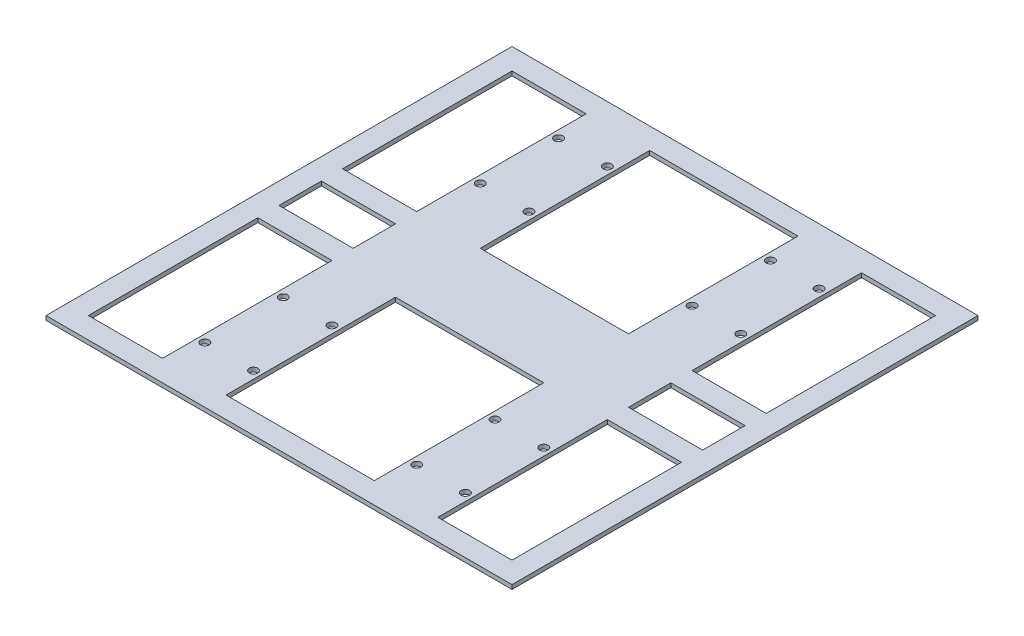
from build123d import *

# Parameters (mm, degrees)
SKETCH_2_W          = 220
SKETCH_2_H          = 220
SKETCH_2_W_2        = 35
SKETCH_2_H_2        = 80
SKETCH_2_W_3        = 70
SKETCH_2_H_3        = 20
EXTRUDE_1_DEPTH     = 2
SKETCH_3_R          = 2
CUT_EXTRUDE_1_DEPTH = 2


with BuildPart() as part:
    # Эскиз2 → Бобышка-Вытянуть1 (new body)
    with BuildSketch(Plane(origin=(0, 0, 0), x_dir=(1, 0, 0), z_dir=(0, 1, 0))):
        with Locations((110, 110)):
            Rectangle(SKETCH_2_W, SKETCH_2_H)
        with Locations((27.5, 170)):
            Rectangle(SKETCH_2_W_2, SKETCH_2_H_2, mode=Mode.SUBTRACT)
        with Locations((110, 170)):
            Rectangle(SKETCH_2_W_3, SKETCH_2_H_2, mode=Mode.SUBTRACT)
        with Locations((192.5, 170)):
            Rectangle(SKETCH_2_W_2, SKETCH_2_H_2, mode=Mode.SUBTRACT)
        with Locations((192.5, 50)):
            Rectangle(SKETCH_2_W_2, SKETCH_2_H_2, mode=Mode.SUBTRACT)
        with Locations((110, 50)):
            Rectangle(SKETCH_2_W_3, SKETCH_2_H_2, mode=Mode.SUBTRACT)
        with Locations((27.5, 50)):
            Rectangle(SKETCH_2_W_2, SKETCH_2_H_2, mode=Mode.SUBTRACT)
        with Locations((27.5, 110)):
            Rectangle(SKETCH_2_W_2, SKETCH_2_H_3, mode=Mode.SUBTRACT)
        with Locations((192.5, 110)):
            Rectangle(SKETCH_2_W_2, SKETCH_2_H_3, mode=Mode.SUBTRACT)
    extrude(amount=EXTRUDE_1_DEPTH)

    # Эскиз3 → Вырез-Вытянуть1 (cut)
    with BuildSketch(Plane(origin=(0, 2, 0), x_dir=(1, 0, 0), z_dir=(0, 1, 0))):
        with Locations(Location((171.5, 26.5, 0), (0, 0, 270))):
            Circle(SKETCH_3_R)
        with Locations(Location((148.5, 26.5, 0), (0, 0, 270))):
            Circle(SKETCH_3_R)
        with Locations(Location((71.5, 26.5, 0), (0, 0, 270))):
            Circle(SKETCH_3_R)
        with Locations(Location((48.5, 26.5, 0), (0, 0, 270))):
            Circle(SKETCH_3_R)
        with Locations(Location((48.5, 63.5, 0), (0, 0, 270))):
            Circle(SKETCH_3_R)
        with Locations(Location((71.5, 63.5, 0), (0, 0, 270))):
            Circle(SKETCH_3_R)
        with Locations(Location((148.5, 63.5, 0), (0, 0, 270))):
            Circle(SKETCH_3_R)
        with Locations(Location((171.5, 63.5, 0), (0, 0, 270))):
            Circle(SKETCH_3_R)
        with Locations(Location((171.5, 156.5, 0), (0, 0, 270))):
            Circle(SKETCH_3_R)
        with Locations(Location((148.5, 156.5, 0), (0, 0, 270))):
            Circle(SKETCH_3_R)
        with Locations(Location((148.5, 193.5, 0), (0, 0, 270))):
            Circle(SKETCH_3_R)
        with Locations(Location((171.5, 193.5, 0), (0, 0, 270))):
            Circle(SKETCH_3_R)
        with Locations(Location((71.5, 193.5, 0), (0, 0, 270))):
            Circle(SKETCH_3_R)
        with Locations(Location((71.5, 156.5, 0), (0, 0, 270))):
            Circle(SKETCH_3_R)
        with Locations(Location((48.5, 156.5, 0), (0, 0, 270))):
            Circle(SKETCH_3_R)
        with Locations(Location((48.5, 193.5, 0), (0, 0, 270))):
            Circle(SKETCH_3_R)
    extrude(amount=-CUT_EXTRUDE_1_DEPTH, mode=Mode.SUBTRACT)


solid = part.part
